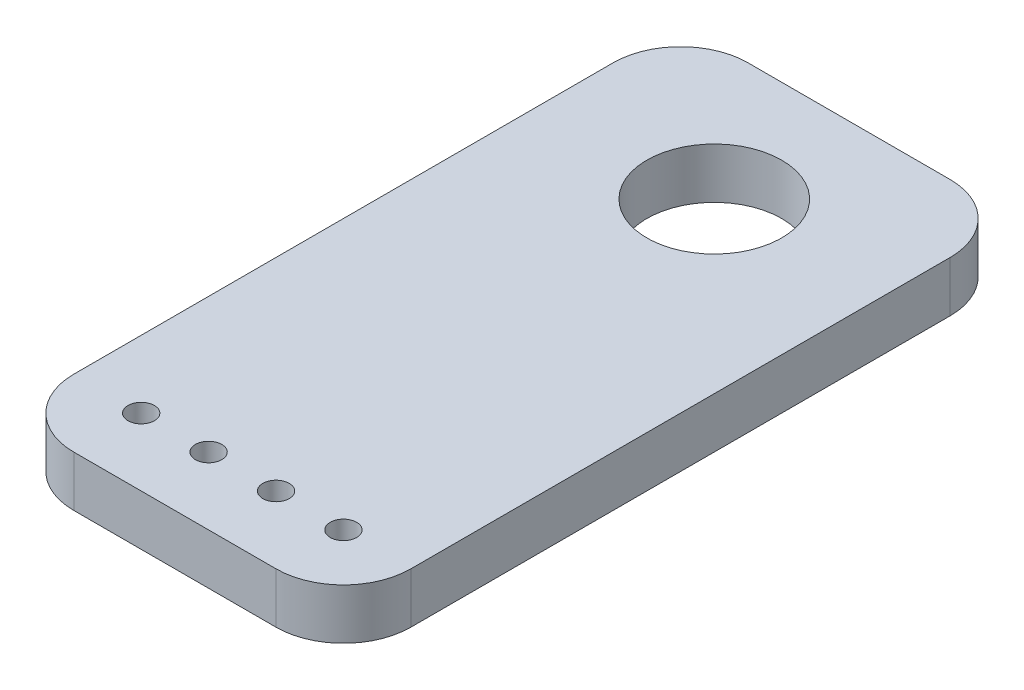
from build123d import *

# Parameters (mm, degrees)
SKETCH1_W           = 63.5
SKETCH1_H           = 127
SKETCH1_R           = 12.7
SKETCH1_R_2         = 2.4892
BOSS_EXTRUDE1_DEPTH = 9.525
FILLET1_R           = 12.7


with BuildPart() as part:
    # Sketch1 → Boss-Extrude1 (new body)
    with BuildSketch(Plane(origin=(0, 0, 0), x_dir=(1, 0, 0), z_dir=(0, 1, 0))):
        with Locations((31.75, -63.5)):
            Rectangle(SKETCH1_W, SKETCH1_H)
        with Locations(Location((31.75, -25.4, 0), (0, 0, 90))):
            Circle(SKETCH1_R, mode=Mode.SUBTRACT)
        with Locations(Location((12.7, -114.3, 0), (0, 0, 90))):
            Circle(SKETCH1_R_2, mode=Mode.SUBTRACT)
        with Locations(Location((25.4, -114.3, 0), (0, 0, 90))):
            Circle(SKETCH1_R_2, mode=Mode.SUBTRACT)
        with Locations(Location((38.1, -114.3, 0), (0, 0, 90))):
            Circle(SKETCH1_R_2, mode=Mode.SUBTRACT)
        with Locations(Location((50.8, -114.3, 0), (0, 0, 90))):
            Circle(SKETCH1_R_2, mode=Mode.SUBTRACT)
    extrude(amount=BOSS_EXTRUDE1_DEPTH)

    # Fillet1
    fillet1_edges = [part.edges().sort_by_distance(p)[0] for p in [
        (0, 4.7625, 0),
        (63.5, 4.7625, 0),
        (63.5, 4.7625, 127),
        (0, 4.7625, 127),
    ]]
    fillet(fillet1_edges, radius=FILLET1_R)


solid = part.part
